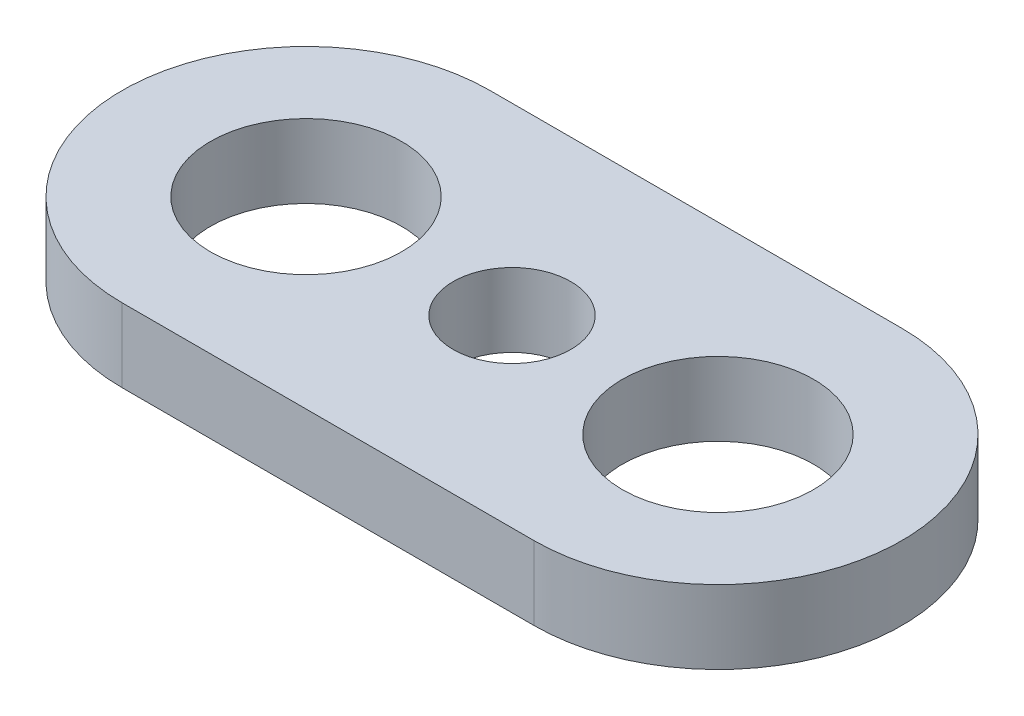
from build123d import *

# Parameters (mm, degrees)
SKETCH_1_R      = 2.6
SKETCH_1_R_2    = 1.6
EXTRUDE_1_DEPTH = 2


with BuildPart() as part:
    # ｽｹｯﾁ1 → ﾎﾞｽ - 押し出し1 (new body)
    with BuildSketch(Plane(origin=(0, 0, 0), x_dir=(1, 0, 0), z_dir=(0, 1, 0))):
        with BuildLine():
            Line((-5.6, 5), (5.6, 5))
            ThreePointArc((5.6, 5), (10.6, 0), (5.6, -5))
            Line((5.6, -5), (-5.6, -5))
            ThreePointArc((-5.6, -5), (-10.6, 0), (-5.6, 5))
        make_face()
        with Locations(Location((-5.6, 0, 0), (0, 0, 270))):
            Circle(SKETCH_1_R, mode=Mode.SUBTRACT)
        with Locations(Location((5.6, 0, 0), (0, 0, 270))):
            Circle(SKETCH_1_R, mode=Mode.SUBTRACT)
        with Locations(Location((0, 0, 0), (0, 0, 270))):
            Circle(SKETCH_1_R_2, mode=Mode.SUBTRACT)
    extrude(amount=EXTRUDE_1_DEPTH)


solid = part.part
